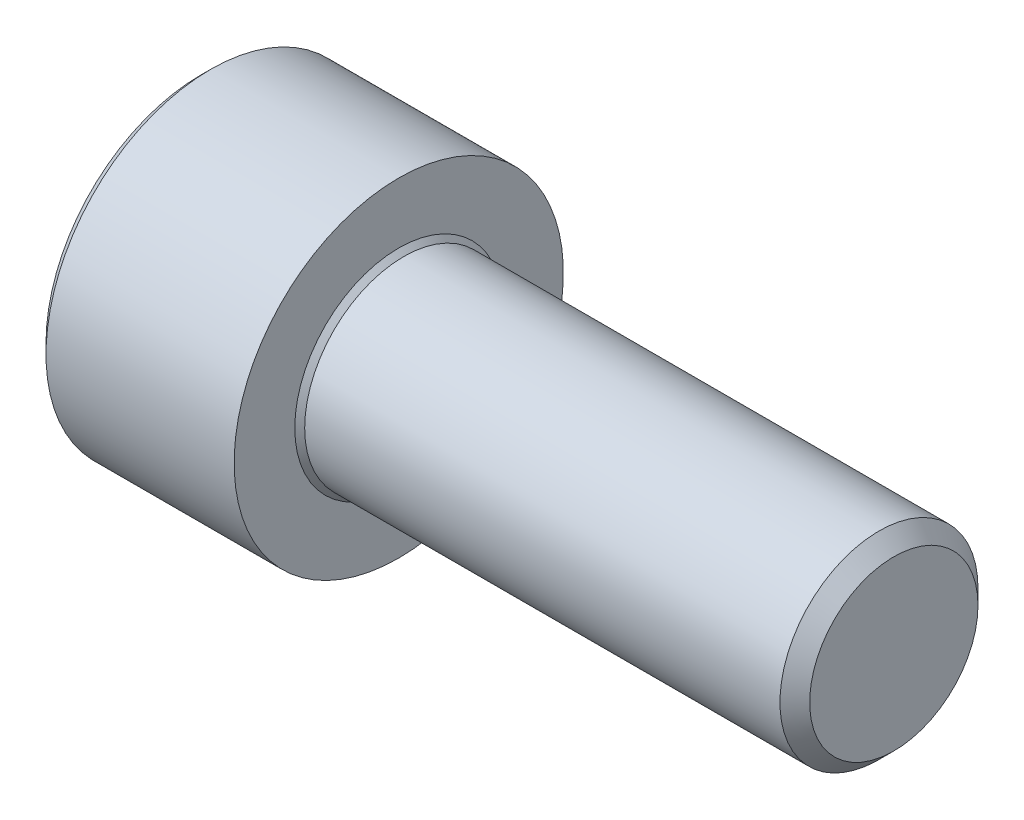
from build123d import *

# Parameters (mm, degrees)
SKETCH2_R           = 4
BOSS_EXTRUDE1_DEPTH = 20
CHAMFER1_SIZE       = 0.6
SKETCH6_W           = 8
SKETCH6_H           = 6.65
CUT_EXTRUDE1_DEPTH  = 4
SKETCH8_R           = 3.629571669
CUT_EXTRUDE2_DEPTH  = 1
CUT_EXTRUDE2_DRAFT  = -45
CHAMFER2_SIZE       = 0.4
CHAMFER3_SIZE       = 0.2


with BuildPart() as part:
    # Sketch2 → Boss-Extrude1 (new body)
    with BuildSketch(Plane(origin=(0, 0, 0), x_dir=(0, 0, -1), z_dir=(1, 0, 0))):
        Circle(SKETCH2_R)
    extrude(amount=-BOSS_EXTRUDE1_DEPTH)

    # Chamfer1
    chamfer1_edges = [part.edges().sort_by_distance(p)[0] for p in [
        (0, 0, 4),
    ]]
    chamfer(chamfer1_edges, length=CHAMFER1_SIZE)

    # Sketch6 → Revolve1 (revolve)
    with BuildSketch(Plane.XY, mode=Mode.PRIVATE) as revolve1_sk:
        with Locations((-24, 3.325)):
            Rectangle(SKETCH6_W, SKETCH6_H)
    revolve(revolve1_sk.sketch.rotate(Axis((-20, 0, 0), (1, 0, 0)), 180), axis=Axis((-20, 0, 0), (1, 0, 0)))

    # Sketch7 → Cut-Extrude1 (cut)
    with BuildSketch(Plane.ZY.offset(28)):
        Polygon((0, 3.579571669), (-3.1, 1.789785834), (-3.1, -1.789785834), (0, -3.579571669), (3.1, -1.789785834), (3.1, 1.789785834), align=None)
    extrude(amount=-CUT_EXTRUDE1_DEPTH, mode=Mode.SUBTRACT)


with BuildPart() as cut_extrude2_tool:
    # Sketch8 → Cut-Extrude2 (with draft: the straight prism first)
    with BuildSketch(Plane.ZY.offset(28)):
        Circle(SKETCH8_R)
    extrude(amount=-CUT_EXTRUDE2_DEPTH)
    # Cut-Extrude2: the draft: its side faces are tilted about the plane it starts from
    cut_extrude2_sides = [cut_extrude2_tool.faces().sort_by_distance(p)[0] for p in [
        (-27.5, 0, -3.629571669),
    ]]
    draft(cut_extrude2_sides, Plane.ZY.offset(28), CUT_EXTRUDE2_DRAFT)


with BuildPart() as part_1:
    add(part.part)

    # Cut-Extrude2: cut by cut_extrude2_tool
    add(cut_extrude2_tool.part, mode=Mode.SUBTRACT)

    # Chamfer2
    chamfer2_edges = [part_1.edges().sort_by_distance(p)[0] for p in [
        (-28, 6.65, 0),
    ]]
    chamfer(chamfer2_edges, length=CHAMFER2_SIZE)

    # Chamfer3
    chamfer3_edges = [part_1.edges().sort_by_distance(p)[0] for p in [
        (-20, 0, 4),
    ]]
    chamfer(chamfer3_edges, length=CHAMFER3_SIZE)


solid = part_1.part
